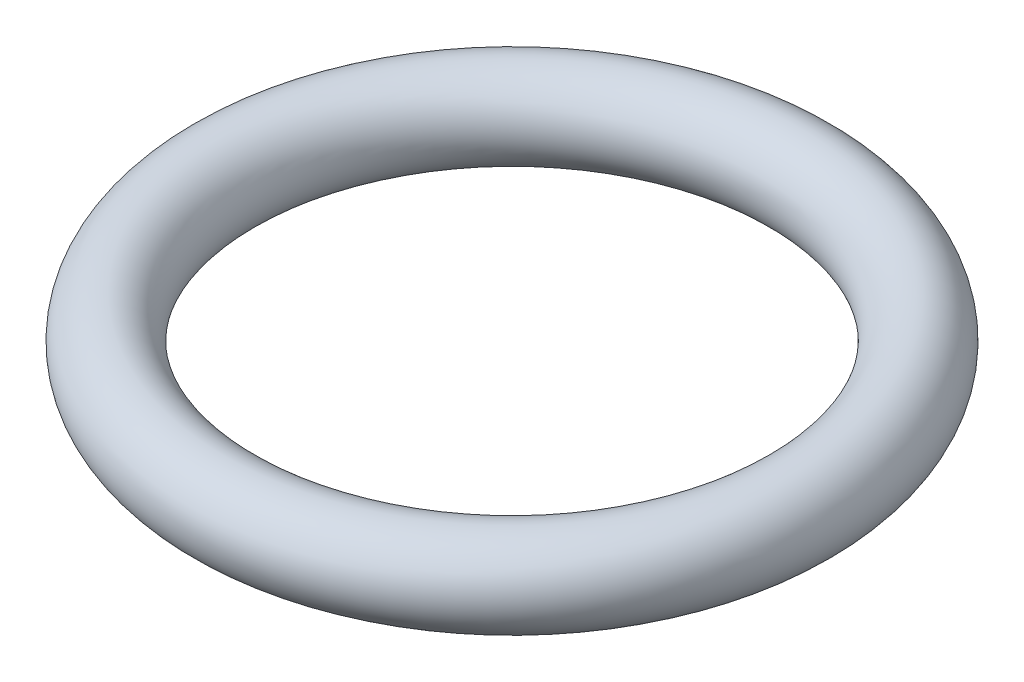
from build123d import *

# Parameters (mm, degrees)
SKETCH1_R = 0.79375


with BuildPart() as part:
    # Sketch1 → Revolve1 (revolve)
    with BuildSketch(Plane.XY):
        with Locations((5.3848, 0)):
            Circle(SKETCH1_R)
    revolve(axis=Axis((0, -48.569779394, 0), (0, 1, 0)))


solid = part.part
